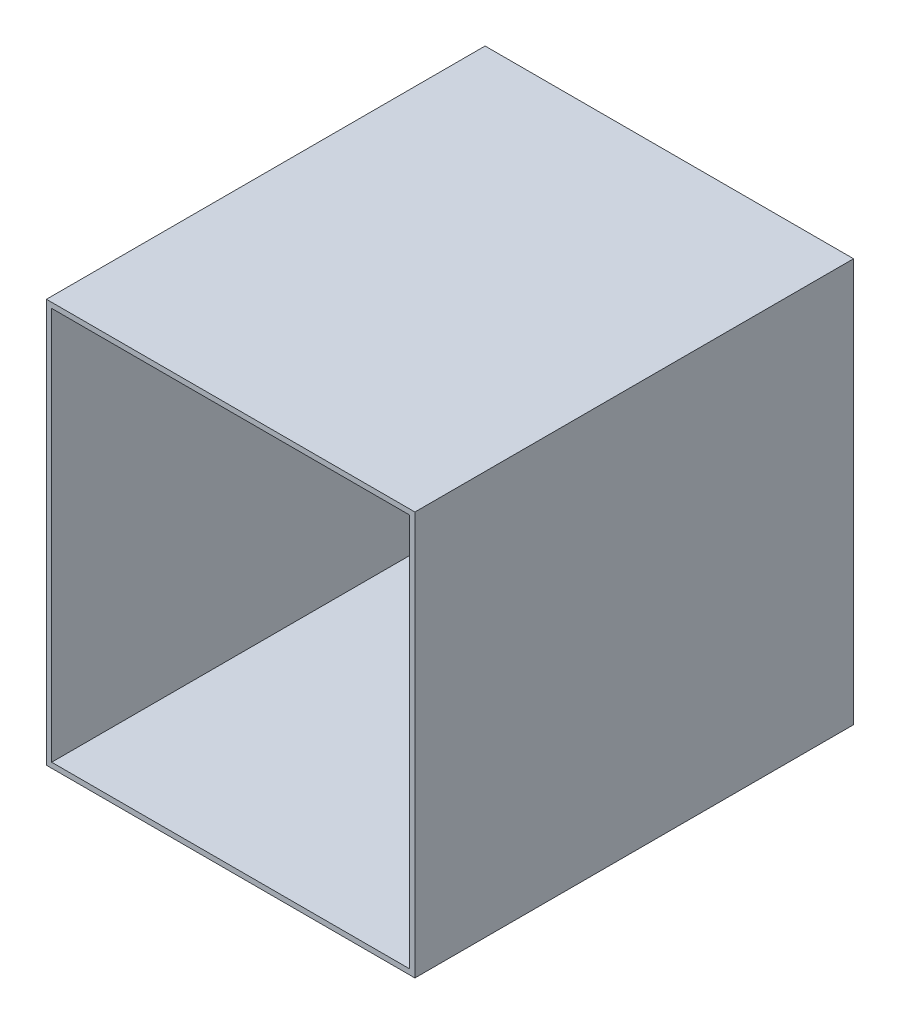
from build123d import *

# Parameters (mm, degrees)
SKETCH1_W           = 210
SKETCH1_H           = 230
SKETCH1_W_2         = 204
SKETCH1_H_2         = 224
BOSS_EXTRUDE1_DEPTH = 250


with BuildPart() as part:
    # Sketch1 → Boss-Extrude1 (new body)
    with BuildSketch(Plane.XY):
        with Locations((-59.250162141, 115)):
            Rectangle(SKETCH1_W, SKETCH1_H)
        with Locations((-59.250162141, 115)):
            Rectangle(SKETCH1_W_2, SKETCH1_H_2, mode=Mode.SUBTRACT)
    extrude(amount=BOSS_EXTRUDE1_DEPTH)


solid = part.part
